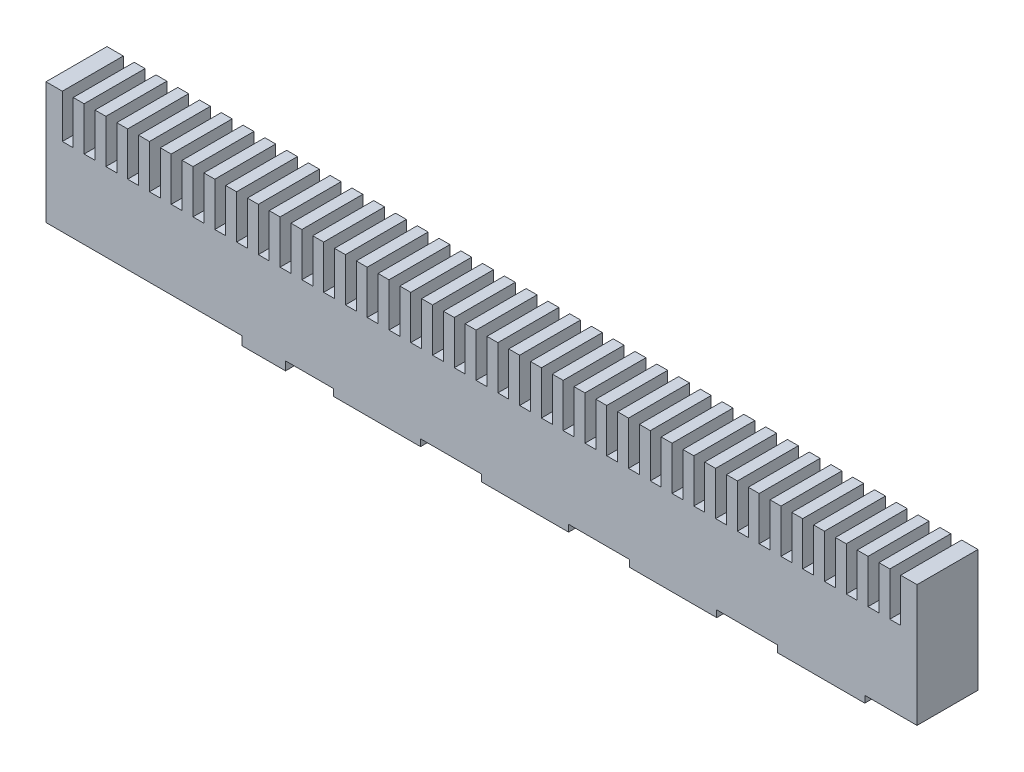
from build123d import *

# Parameters (mm, degrees)
SKETCH1_W           = 200
SKETCH1_H           = 14
BOSS_EXTRUDE1_DEPTH = 30
SKETCH2_W           = 12
SKETCH2_H           = 14
SKETCH2_W_2         = 14
SKETCH2_W_3         = 11
SKETCH2_W_4         = 45
CUT_EXTRUDE1_DEPTH  = 2
SKETCH3_W           = 20
SKETCH3_H           = 14
CUT_EXTRUDE2_DEPTH  = 0.435
CUT_EXTRUDE4_DEPTH  = 203.721483815


with BuildPart() as part:
    # Sketch1 → Boss-Extrude1 (new body)
    with BuildSketch(Plane(origin=(0, 0, 0), x_dir=(1, 0, 0), z_dir=(0, 1, 0))):
        with Locations((100, 7)):
            Rectangle(SKETCH1_W, SKETCH1_H)
    extrude(amount=BOSS_EXTRUDE1_DEPTH)

    # Sketch2 → Cut-Extrude1 (cut)
    with BuildSketch(Plane.XZ):
        with Locations((194, -7)):
            Rectangle(SKETCH2_W, SKETCH2_H)
        with Locations((161, -7)):
            Rectangle(SKETCH2_W_2, SKETCH2_H)
        with Locations((127, -7)):
            Rectangle(SKETCH2_W_2, SKETCH2_H)
        with Locations((93, -7)):
            Rectangle(SKETCH2_W_2, SKETCH2_H)
        with Locations((60.5, -7)):
            Rectangle(SKETCH2_W_3, SKETCH2_H)
        with Locations((22.5, -7)):
            Rectangle(SKETCH2_W_4, SKETCH2_H)
    extrude(amount=-CUT_EXTRUDE1_DEPTH, mode=Mode.SUBTRACT)

    # Sketch3 → Cut-Extrude2 (cut)
    with BuildSketch(Plane.XZ):
        with Locations((76, -7)):
            Rectangle(SKETCH3_W, SKETCH3_H)
        with Locations((110, -7)):
            Rectangle(SKETCH3_W, SKETCH3_H)
        with Locations((144, -7)):
            Rectangle(SKETCH3_W, SKETCH3_H)
        with Locations((178, -7)):
            Rectangle(SKETCH3_W, SKETCH3_H)
    extrude(amount=-CUT_EXTRUDE2_DEPTH, mode=Mode.SUBTRACT)

    # Sketch5 → Cut-Extrude4 (cut, through all)
    with BuildSketch(Plane.XY):
        Polygon((3.75, 30), (3.75, 20), (6.25, 20), (6.25, 30), (8.75, 30), (8.75, 20), (11.25, 20), (11.25, 30), (13.75, 30), (13.75, 20), (16.25, 20), (16.25, 30), (18.75, 30), (18.75, 20), (21.25, 20), (21.25, 30), (23.75, 30), (23.75, 20), (26.25, 20), (26.25, 30), (28.75, 30), (28.75, 20), (31.25, 20), (31.25, 30), (33.75, 30), (33.75, 20), (36.25, 20), (36.25, 30), (38.75, 30), (38.75, 20), (41.25, 20), (41.25, 30), (43.75, 30), (43.75, 20), (46.25, 20), (46.25, 30), (48.75, 30), (48.75, 20), (51.25, 20), (51.25, 30), (53.75, 30), (53.75, 20), (56.25, 20), (56.25, 30), (58.75, 30), (58.75, 20), (61.25, 20), (61.25, 30), (63.75, 30), (63.75, 20), (66.25, 20), (66.25, 30), (68.75, 30), (68.75, 20), (71.25, 20), (71.25, 30), (73.75, 30), (73.75, 20), (76.25, 20), (76.25, 30), (78.75, 30), (78.75, 20), (81.25, 20), (81.25, 30), (83.75, 30), (83.75, 20), (86.25, 20), (86.25, 30), (88.75, 30), (88.75, 20), (91.25, 20), (91.25, 30), (93.75, 30), (93.75, 20), (96.25, 20), (96.25, 30), (98.75, 30), (98.75, 20), (101.25, 20), (101.25, 30), (103.75, 30), (103.75, 20), (106.25, 20), (106.25, 30), (108.75, 30), (108.75, 20), (111.25, 20), (111.25, 30), (113.75, 30), (113.75, 20), (116.25, 20), (116.25, 30), (118.75, 30), (118.75, 20), (121.25, 20), (121.25, 30), (123.75, 30), (123.75, 20), (126.25, 20), (126.25, 30), (128.75, 30), (128.75, 20), (131.25, 20), (131.25, 30), (133.75, 30), (133.75, 20), (136.25, 20), (136.25, 30), (138.75, 30), (138.75, 20), (141.25, 20), (141.25, 30), (143.75, 30), (143.75, 20), (146.25, 20), (146.25, 30), (148.75, 30), (148.75, 20), (151.25, 20), (151.25, 30), (153.75, 30), (153.75, 20), (156.25, 20), (156.25, 30), (158.75, 30), (158.75, 20), (161.25, 20), (161.25, 30), (163.75, 30), (163.75, 20), (166.25, 20), (166.25, 30), (168.75, 30), (168.75, 20), (171.25, 20), (171.25, 30), (173.75, 30), (173.75, 20), (176.25, 20), (176.25, 30), (178.75, 30), (178.75, 20), (181.25, 20), (181.25, 30), (183.75, 30), (183.75, 20), (186.25, 20), (186.25, 30), (188.75, 30), (188.75, 20), (191.25, 20), (191.25, 30), (193.75, 30), (193.75, 20), (196.25, 20), (196.25, 30), (196.25, 37.451923055), (3.75, 37.451923055), align=None)
    extrude(amount=-CUT_EXTRUDE4_DEPTH, mode=Mode.SUBTRACT)


solid = part.part
